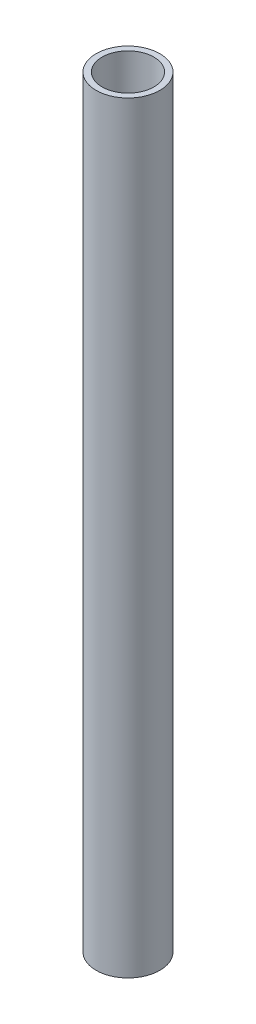
from build123d import *

# Parameters (mm, degrees)
SKETCH1_R           = 10.45
BOSS_EXTRUDE1_DEPTH = 250
SKETCH2_R           = 8.5
CUT_EXTRUDE1_DEPTH  = 251.436429059


with BuildPart() as part:
    # Sketch1 → Boss-Extrude1 (new body)
    with BuildSketch(Plane(origin=(0, 0, 0), x_dir=(1, 0, 0), z_dir=(0, 1, 0))):
        with Locations(Location((0, 0, 0), (0, 0, 270))):
            Circle(SKETCH1_R)
    extrude(amount=BOSS_EXTRUDE1_DEPTH)

    # Sketch2 → Cut-Extrude1 (cut, through all)
    with BuildSketch(Plane(origin=(0, 0, 0), x_dir=(-1, 0, 0), z_dir=(0, -1, 0))):
        with Locations(Location((0, 0, 0), (0, 0, 90))):
            Circle(SKETCH2_R)
    extrude(amount=-CUT_EXTRUDE1_DEPTH, mode=Mode.SUBTRACT)


solid = part.part
